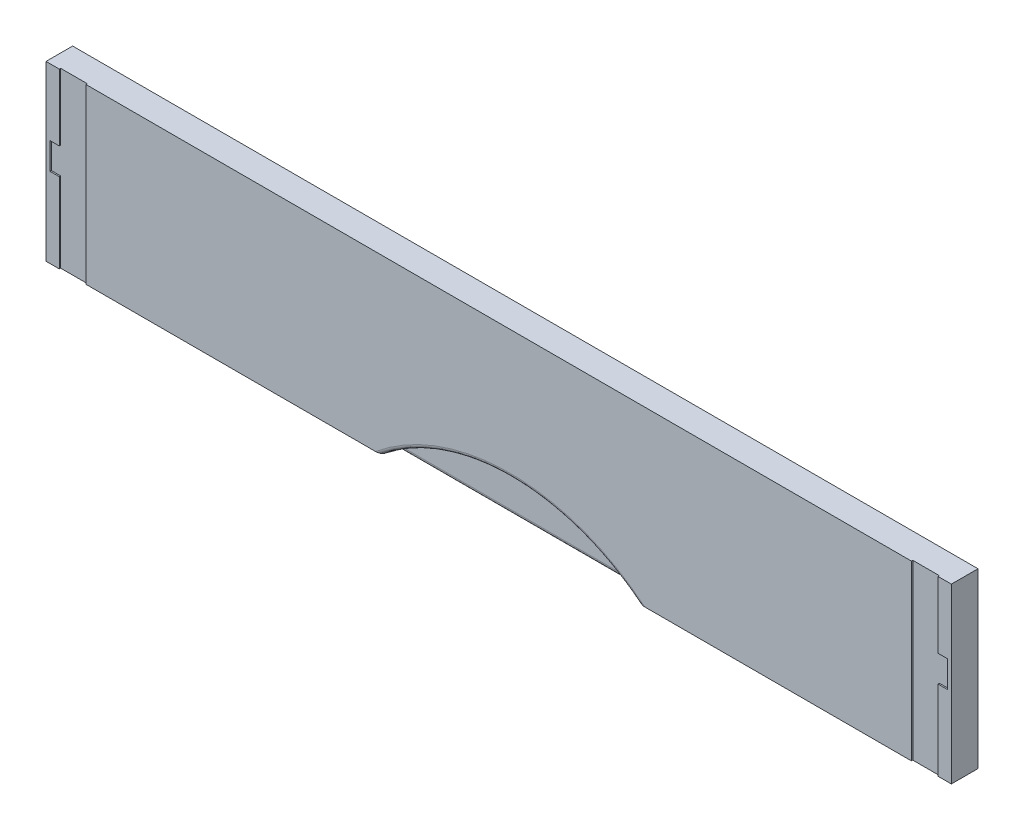
from build123d import *

# Parameters (mm, degrees)
CROQUIS1_W              = 680
CROQUIS1_H              = 130
SALIENTE_EXTRUIR1_DEPTH = 20
CORTAR_EXTRUIR6_DEPTH   = 10
REDONDEO6_R             = 3
REDONDEO7_R             = 3
CORTAR_EXTRUIR9_DEPTH   = 1
CORTAR_EXTRUIR10_DEPTH  = 1


with BuildPart() as part:
    # Croquis1 → Saliente-Extruir1 (new body)
    with BuildSketch(Plane.XY):
        Rectangle(CROQUIS1_W, CROQUIS1_H)
    extrude(amount=SALIENTE_EXTRUIR1_DEPTH)

    # Croquis4 → Cortar-Extruir6 (cut)
    with BuildSketch(Plane.XY.offset(20)):
        with BuildLine():
            Line((-87.688515054, -65), (104.950033766, -65))
            ThreePointArc((104.950033766, -65), (8.630759356, -31.56754978), (-87.688515054, -65))
        make_face()
    extrude(amount=-CORTAR_EXTRUIR6_DEPTH, mode=Mode.SUBTRACT)

    # Redondeo6
    redondeo6_edges = [part.edges().sort_by_distance(p)[0] for p in [
        (8.630759356, -31.56754978, 20),
    ]]
    fillet(redondeo6_edges, radius=REDONDEO6_R)

    # Redondeo7
    redondeo7_edges = [part.edges().sort_by_distance(p)[0] for p in [
        (8.630759356, -65, 10),
    ]]
    fillet(redondeo7_edges, radius=REDONDEO7_R)

    # Croquis5 → Cortar-Extruir9 (cut)
    with BuildSketch(Plane.XY.offset(20)):
        Polygon((310, 65), (310, -65), (330, -65), (330, -5), (337, -5), (337, 15), (330, 15), (330, 65), align=None)
    extrude(amount=-CORTAR_EXTRUIR9_DEPTH, mode=Mode.SUBTRACT)

    # Croquis6 → Cortar-Extruir10 (cut)
    with BuildSketch(Plane.XY.offset(20)):
        Polygon((-310, 65), (-310, -65), (-330, -65), (-330, -5), (-337, -5), (-337, 15), (-330, 15), (-330, 65), align=None)
    extrude(amount=-CORTAR_EXTRUIR10_DEPTH, mode=Mode.SUBTRACT)


solid = part.part
